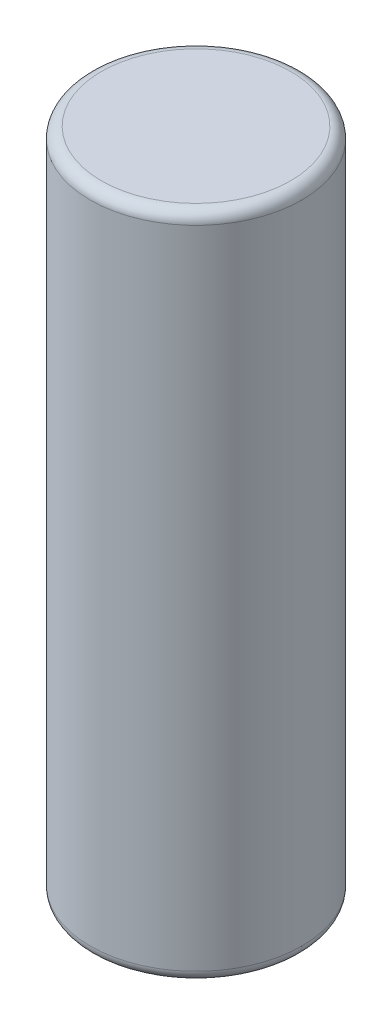
from build123d import *

# Parameters (mm, degrees)
SKETCH_1_R      = 9.5
EXTRUDE_1_DEPTH = 60
FILLET_1_R      = 1


with BuildPart() as part:
    # 草图1 → 凸台-拉伸1 (new body)
    with BuildSketch(Plane(origin=(0, 0, 0), x_dir=(1, 0, 0), z_dir=(0, 1, 0))):
        with Locations(Location((0, 0, 0), (0, 0, 270))):
            Circle(SKETCH_1_R)
    extrude(amount=EXTRUDE_1_DEPTH)

    # 圆角1
    fillet_1_edges = [part.edges().sort_by_distance(p)[0] for p in [
        (0, 0, -9.5),
        (0, 60, -9.5),
    ]]
    fillet(fillet_1_edges, radius=FILLET_1_R)


solid = part.part
